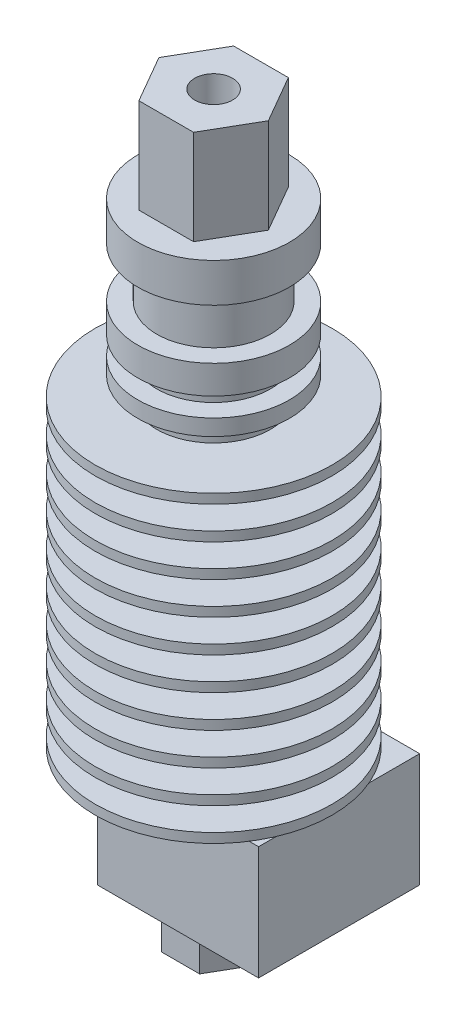
from build123d import *

# Parameters (mm, degrees)
BOSS_EXTRUDE1_START = 3
SKETCH2_R           = 1.792662358
SKETCH2_R_2         = 1
BOSS_EXTRUDE1_DEPTH = 3
SKETCH3_W           = 17
SKETCH3_H           = 17
SKETCH3_R           = 1
BOSS_EXTRUDE2_DEPTH = 12
BOSS_EXTRUDE3_START = 3
SKETCH4_R           = 1
BOSS_EXTRUDE3_DEPTH = 3
SKETCH8_R           = 2
BOSS_EXTRUDE4_DEPTH = 10


with BuildPart() as part:
    # Sketch1 → Revolve1 (revolve)
    with BuildSketch(Plane.XY):
        Polygon((1, 0), (12.5, 0), (12.5, 1), (8, 1), (8, 3.444444444), (12.5, 3.444444444), (12.5, 4.444444444), (8, 4.444444444), (8, 6.888888889), (12.5, 6.888888889), (12.5, 7.888888889), (8, 7.888888889), (8, 10.333333333), (12.5, 10.333333333), (12.5, 11.333333333), (8, 11.333333333), (8, 13.777777778), (12.5, 13.777777778), (12.5, 14.777777778), (8, 14.777777778), (8, 17.222222222), (12.5, 17.222222222), (12.5, 18.222222222), (8, 18.222222222), (8, 20.666666667), (12.5, 20.666666667), (12.5, 21.666666667), (8, 21.666666667), (8, 24.111111111), (12.5, 24.111111111), (12.5, 25.111111111), (8, 25.111111111), (8, 27.555555556), (12.5, 27.555555556), (12.5, 28.555555556), (8, 28.555555556), (8, 31), (12.5, 31), (12.5, 32), (6, 32), (6, 34), (8, 34), (8, 35.7), (6, 35.7), (6, 37.7), (8, 37.7), (8, 40.7), (6, 40.7), (6, 46), (8, 46), (8, 50.1), (1, 50.1), align=None)
    revolve(axis=Axis((0, 0, 0), (0, 1, 0)))

    # Sketch2 → Boss-Extrude1 (add)
    with BuildSketch(Plane.XZ.offset(BOSS_EXTRUDE1_START)):
        Circle(SKETCH2_R)
        Circle(SKETCH2_R_2, mode=Mode.SUBTRACT)
    extrude(amount=-BOSS_EXTRUDE1_DEPTH)

    # Sketch8 → Boss-Extrude4 (add)
    with BuildSketch(Plane(origin=(0, 50.1, 0), x_dir=(1, 0, 0), z_dir=(0, 1, 0))):
        Polygon((2.886751346, 5), (-2.886751346, 5), (-5.773502692, 0), (-2.886751346, -5), (2.886751346, -5), (5.773502692, 0), align=None)
        Circle(SKETCH8_R, mode=Mode.SUBTRACT)
    extrude(amount=BOSS_EXTRUDE4_DEPTH)


with BuildPart() as body_2:
    # Sketch3 → Boss-Extrude2 (new body)
    with BuildSketch(Plane.XZ.offset(3)):
        with Locations((0, -4.742198182)):
            Rectangle(SKETCH3_W, SKETCH3_H)
        Circle(SKETCH3_R, mode=Mode.SUBTRACT)
    extrude(amount=BOSS_EXTRUDE2_DEPTH)

    # Sketch4 → Boss-Extrude3 (add)
    with BuildSketch(Plane.XZ.offset(15).offset(BOSS_EXTRUDE3_START)):
        Polygon((2.020725942, 3.5), (-2.020725942, 3.5), (-4.041451884, 0), (-2.020725942, -3.5), (2.020725942, -3.5), (4.041451884, 0), align=None)
        Circle(SKETCH4_R, mode=Mode.SUBTRACT)
    extrude(amount=-BOSS_EXTRUDE3_DEPTH)

    # Sketch5 → Revolve2 (revolve)
    with BuildSketch(Plane.XY):
        Polygon((0.2, -18), (0.2, -20), (2.945271199, -18), align=None)
    revolve(axis=Axis((0, 0, 0), (0, -1, 0)))


solid = Compound([part.part, body_2.part])
